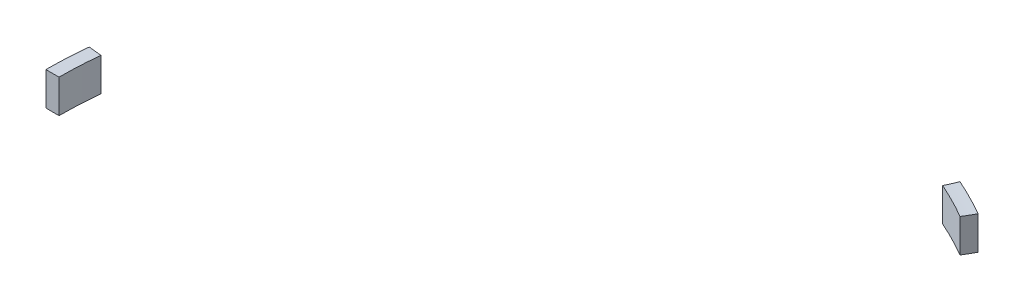
from build123d import *

# Parameters (mm, degrees)
CUT_EXTRUDE2_DEPTH = 20


with BuildPart() as part:
    # Sweep1: sweep along a path in Sketch2
    with BuildLine(Plane(origin=(0, 0, 0), x_dir=(1, 0, 0), z_dir=(0, 1, 0))) as sweep1_path:
        ThreePointArc((44.295, 25.573730174), (14.765, 25.573730174), (0, 0))
    # Sketch1 → Sweep1 (sweep)
    with BuildSketch(Plane.XY):
        with BuildLine():
            Line((-0.5, -13.550778575), (-0.5, -16.097236564))
            ThreePointArc((-0.5, -16.097236564), (0, -16.105), (0.5, -16.097236564))
            Line((0.5, -16.097236564), (0.5, -13.550778575))
            ThreePointArc((0.5, -13.550778575), (0, -13.56), (-0.5, -13.550778575))
        make_face()
    sweep(path=sweep1_path.line)

    # Sketch3 → Cut-Extrude2 (cut)
    with BuildSketch(Plane(origin=(0, 0, 0), x_dir=(1, 0, 0), z_dir=(0, 1, 0))):
        with BuildLine():
            ThreePointArc((0.659029377, 3.034461289), (15.015, 25.140717472), (41.337564748, 26.520224635))
            Line((41.337564748, 26.520224635), (41.744301392, 27.433770093))
            ThreePointArc((41.744301392, 27.433770093), (14.515, 26.006742876), (-0.335492518, 3.138989752))
            Line((-0.335492518, 3.138989752), (0.659029377, 3.034461289))
        make_face()
    extrude(amount=-CUT_EXTRUDE2_DEPTH, mode=Mode.SUBTRACT)


with BuildPart() as cut_extrude2_piece_1:
    # of the separate pieces the step leaves, piece 1, a body of its own (cut_extrude2_pieces)
    add(part.part.solids().sort_by_distance((44.045, -16.097236564, -25.140717472))[0])


with BuildPart() as cut_extrude2_piece_2:
    # of the separate pieces the step leaves, piece 2, a body of its own (cut_extrude2_pieces)
    add(part.part.solids().sort_by_distance((0.659029377, -13.550778575, -3.034461289))[0])


solid = Compound([cut_extrude2_piece_1.part, cut_extrude2_piece_2.part])
